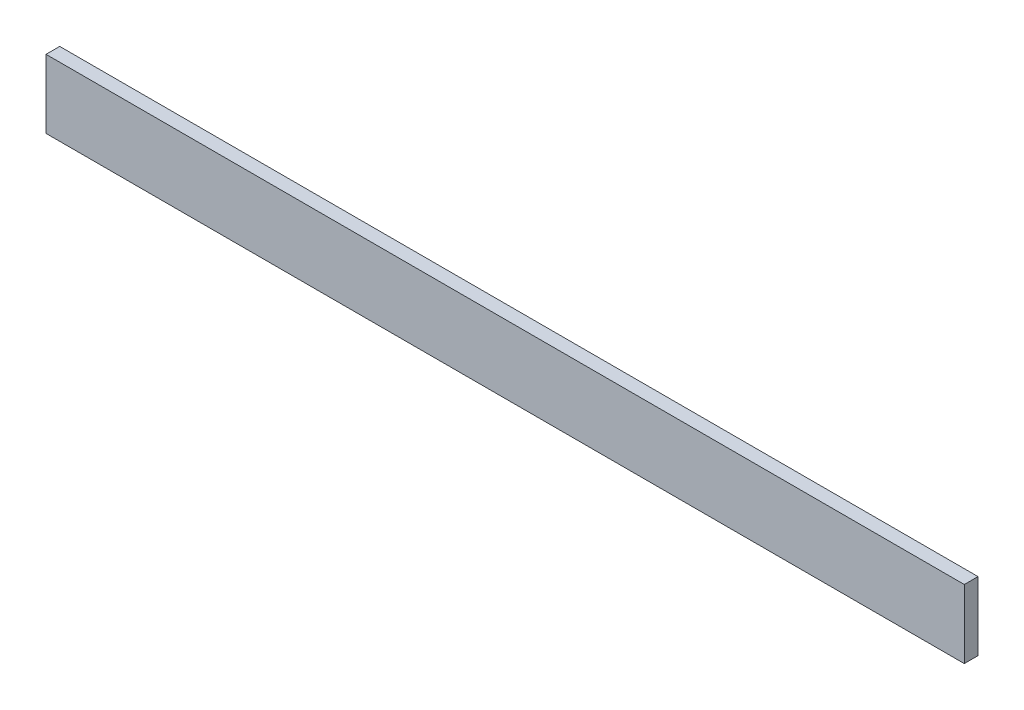
from build123d import *

# Parameters (mm, degrees)
SKETCH1_W           = 850.9
SKETCH1_H           = 63.5
BOSS_EXTRUDE1_DEPTH = 12.7


with BuildPart() as part:
    # Sketch1 → Boss-Extrude1 (new body)
    with BuildSketch(Plane.XY):
        with Locations((425.45, 31.75)):
            Rectangle(SKETCH1_W, SKETCH1_H)
    extrude(amount=BOSS_EXTRUDE1_DEPTH)


solid = part.part
